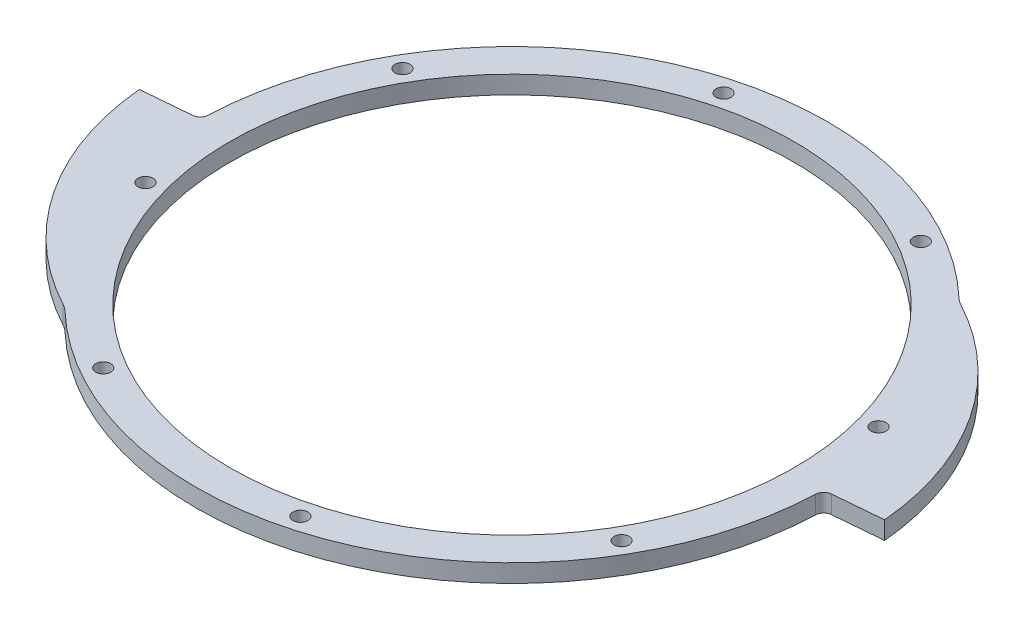
from build123d import *

# Parameters (mm, degrees)
SKETCH1_R                = 100
BOSS_EXTRUDE1_DEPTH      = 3.175
FILLET1_R                = 3
CIRPATTERN1_COUNT        = 2
FILLET1_OF_CIRPATTERN1_R = 3
SKETCH2_R                = 2.65
CUT_EXTRUDE1_DEPTH       = 174.229104079
CIRPATTERN2_COUNT        = 8


with BuildPart() as part:
    # Sketch1 → Boss-Extrude1 (new, symmetric)
    with BuildSketch(Plane(origin=(0, 0, 0), x_dir=(1, 0, 0), z_dir=(0, 1, 0))):
        with BuildLine():
            Line((-111.986312116, 1.750970805), (-132, 0))
            ThreePointArc((-132, 0), (-115.815804966, -46.398149165), (-79.477414809, -79.477414809))
            ThreePointArc((-79.477414809, -79.477414809), (-78.32708198, -80.19539315), (-77.284459499, -81.062397694))
            ThreePointArc((-77.284459499, -81.062397694), (103.297481806, 43.285450818), (-111.986312116, 1.750970805))
        make_face()
        with Locations(Location((0, 0, 0), (0, 0, 270))):
            Circle(SKETCH1_R, mode=Mode.SUBTRACT)
    boss_extrude1 = extrude(amount=BOSS_EXTRUDE1_DEPTH, both=True)

    # Fillet1
    fillet1_edges = [part.edges().sort_by_distance(p)[0] for p in [
        (-111.986312116, 0, -1.750970805),
    ]]
    fillet(fillet1_edges, radius=FILLET1_R)

    # CirPattern1: Boss-Extrude1 ×2 about axis
    cirpattern1_axis = Axis((0, 0, 0), (0, 1, 0))
    for i in range(1, CIRPATTERN1_COUNT):
        add(boss_extrude1.rotate(cirpattern1_axis, i * 360 / CIRPATTERN1_COUNT))

    # Fillet1 of CirPattern1
    fillet1_of_cirpattern1_edges = [part.edges().sort_by_distance(p)[0] for p in [
        (111.986312116, 0, 1.750970805),
    ]]
    fillet(fillet1_of_cirpattern1_edges, radius=FILLET1_OF_CIRPATTERN1_R)

    # Sketch2 → Cut-Extrude1 (cut, through all)
    with BuildSketch(Plane(origin=(0, 3.175, 0), x_dir=(1, 0, 0), z_dir=(0, 1, 0))):
        with Locations(Location((-102.388137587, -27.434818781, 0), (0, 0, 270))):
            Circle(SKETCH2_R)
    cut_extrude1 = extrude(amount=-CUT_EXTRUDE1_DEPTH, mode=Mode.SUBTRACT)

    # CirPattern2: Cut-Extrude1 ×8 about axis
    cirpattern2_axis = Axis((0, 0, 0), (0, 1, 0))
    for i in range(1, CIRPATTERN2_COUNT):
        add(cut_extrude1.rotate(cirpattern2_axis, i * 360 / CIRPATTERN2_COUNT), mode=Mode.SUBTRACT)


solid = part.part
